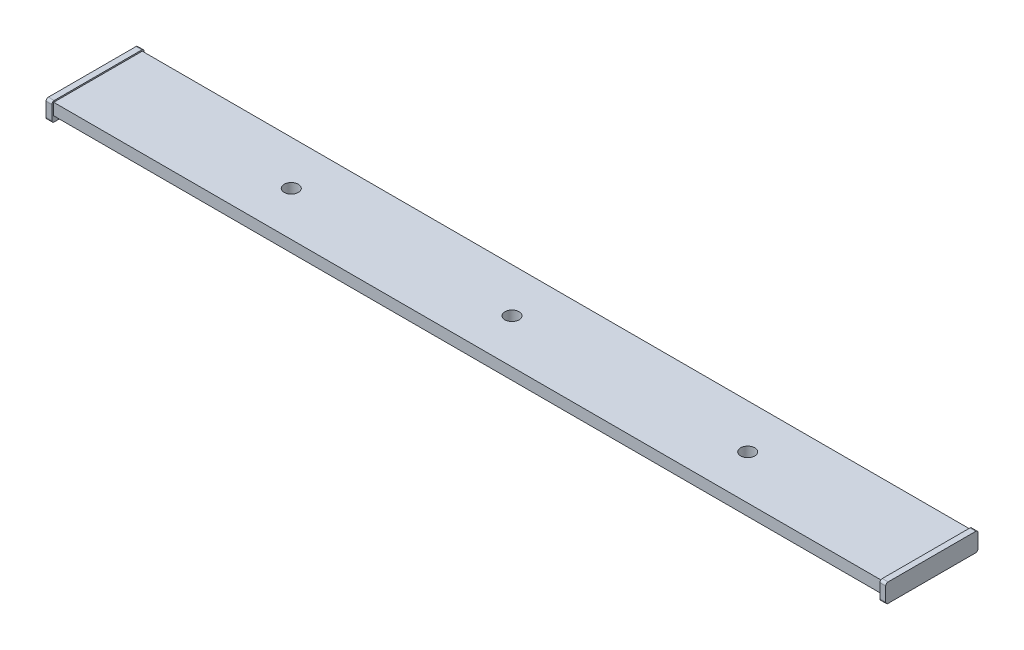
from build123d import *

# Parameters (mm, degrees)
SKETCH1_W           = 3600
SKETCH1_H           = 379.6875
BOSS_EXTRUDE1_DEPTH = 50
SKETCH2_W           = 3653.851372928
SKETCH2_H           = 15
CUT_EXTRUDE1_DEPTH  = 25
SKETCH3_R           = 30.381139082
CUT_EXTRUDE2_DEPTH  = 1811.674087022
BOSS_EXTRUDE2_DEPTH = 25


with BuildPart() as part:
    # Sketch1 → Boss-Extrude1 (new body)
    with BuildSketch(Plane(origin=(0, 0, 0), x_dir=(1, 0, 0), z_dir=(0, 1, 0))):
        Rectangle(SKETCH1_W, SKETCH1_H)
    extrude(amount=BOSS_EXTRUDE1_DEPTH)

    # Sketch2 → Cut-Extrude1 (cut)
    with BuildSketch(Plane.XZ):
        with Locations((26.925686464, 150.111800851)):
            Rectangle(SKETCH2_W, SKETCH2_H)
        with Locations((26.925686464, -150.111800851)):
            Rectangle(SKETCH2_W, SKETCH2_H)
    extrude(amount=-CUT_EXTRUDE1_DEPTH, mode=Mode.SUBTRACT)

    # Sketch3 → Cut-Extrude2 (cut, through all)
    with BuildSketch(Plane.XZ):
        with Locations(Location((0, 0, 0), (0, 0, 270))):
            Circle(SKETCH3_R)
        with Locations(Location((-946.305515807, 0, 0), (0, 0, 270))):
            Circle(SKETCH3_R)
        with Locations(Location((1010.603651897, 0, 0), (0, 0, 270))):
            Circle(SKETCH3_R)
    extrude(amount=-CUT_EXTRUDE2_DEPTH, mode=Mode.SUBTRACT)

    # Sketch4 → Boss-Extrude2 (add)
    with BuildSketch(Plane(origin=(1800, 0, 0), x_dir=(0, 0, -1), z_dir=(1, 0, 0))):
        with BuildLine():
            Line((-187.814440115, -24.190456177), (187.814440115, -24.190456177))
            ThreePointArc((187.814440115, -24.190456177), (194.885507927, -21.261523989), (197.814440115, -14.190456177))
            Line((197.814440115, -14.190456177), (197.814440115, 45.681163873))
            ThreePointArc((197.814440115, 45.681163873), (194.885507927, 52.752231685), (187.814440115, 55.681163873))
            Line((187.814440115, 55.681163873), (-187.814440115, 55.681163873))
            ThreePointArc((-187.814440115, 55.681163873), (-194.885507927, 52.752231685), (-197.814440115, 45.681163873))
            Line((-197.814440115, 45.681163873), (-197.814440115, -14.190456177))
            ThreePointArc((-197.814440115, -14.190456177), (-194.885507927, -21.261523989), (-187.814440115, -24.190456177))
        make_face()
    boss_extrude2 = extrude(amount=-BOSS_EXTRUDE2_DEPTH)

    # Mirror1: Boss-Extrude2 across plane
    add(boss_extrude2.mirror(Plane(origin=(0, 0, 0), x_dir=(0, 0, 1), z_dir=(1, 0, 0))))


solid = part.part
